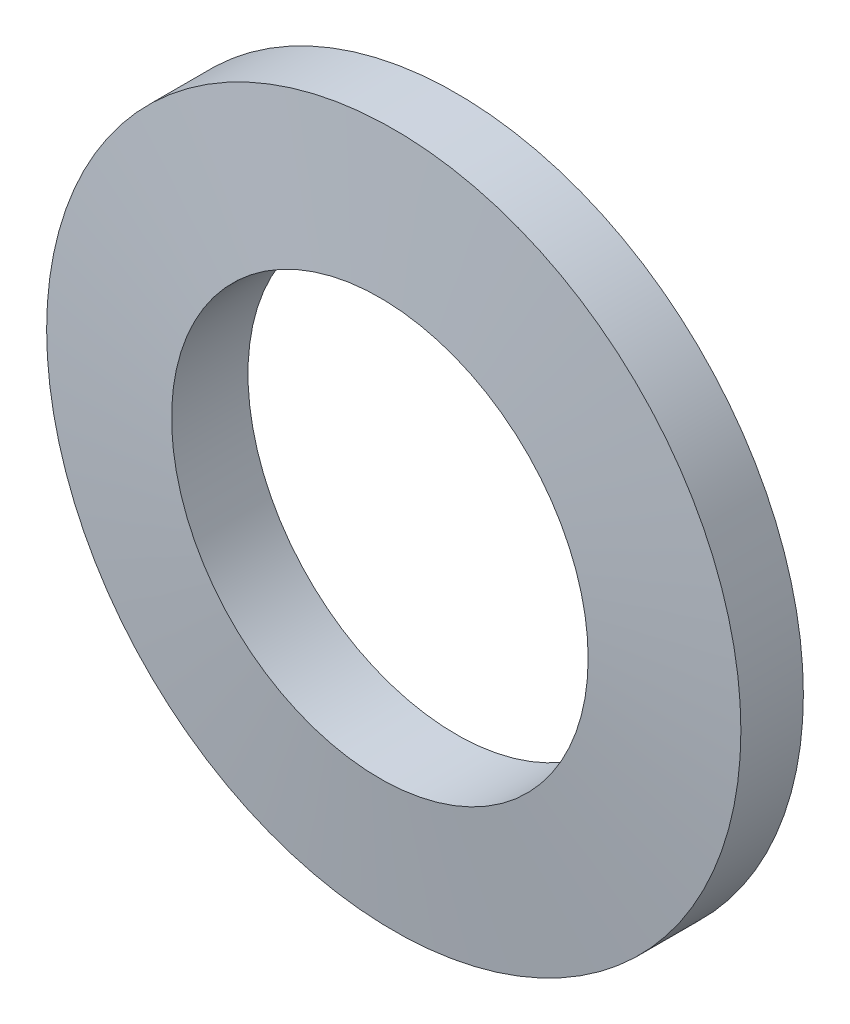
from build123d import *


with BuildPart() as part:
    # Sketch1 → Revolve1 (revolve)
    with BuildSketch(Plane(origin=(0, 0, 0), x_dir=(0, 0, -1), z_dir=(1, 0, 0)), mode=Mode.PRIVATE) as revolve1_sk:
        Polygon((0, 30), (11, 30), (11, 50), (2, 50), align=None)
    revolve(revolve1_sk.sketch.rotate(Axis((0, 0, 0), (0, 0, -1)), 90), axis=Axis((0, 0, 0), (0, 0, -1)))


solid = part.part
